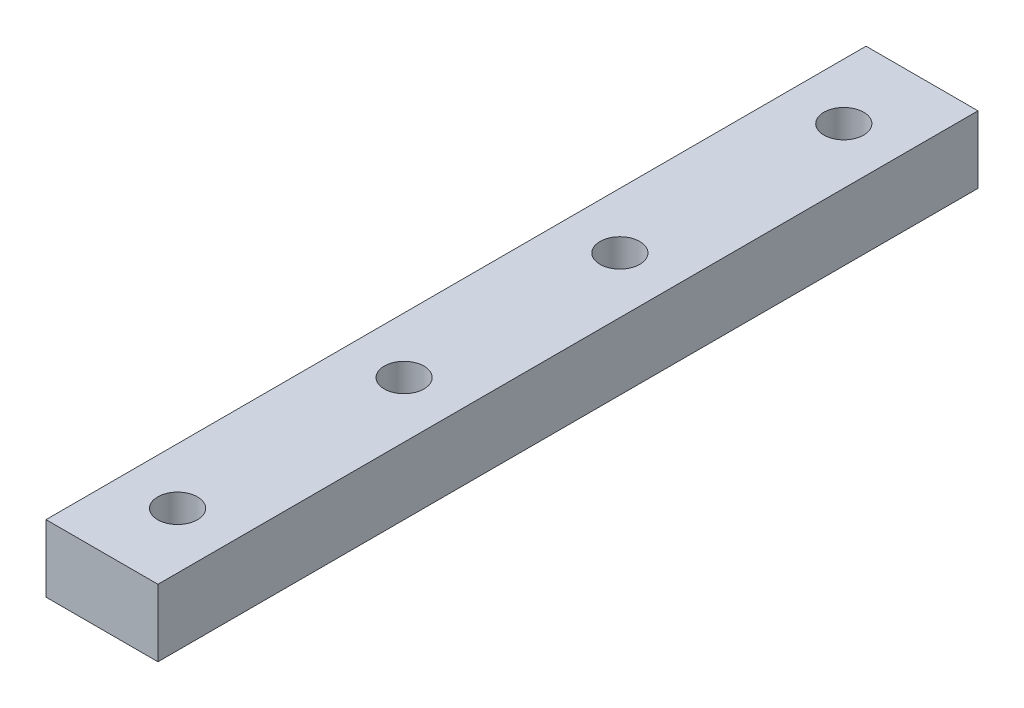
from build123d import *

# Parameters (mm, degrees)
SKETCH1_W                  = 20
SKETCH1_H                  = 146.5
BOSS_EXTRUDE1_DEPTH        = 12
F_7_1_7_1_DIAMETER_HOLE1_D = 7.1


with BuildPart() as part:
    # Sketch1 → Boss-Extrude1 (new body)
    with BuildSketch(Plane(origin=(0, 0, 0), x_dir=(1, 0, 0), z_dir=(0, 1, 0))):
        Rectangle(SKETCH1_W, SKETCH1_H)
    extrude(amount=BOSS_EXTRUDE1_DEPTH)

    # Ø7.1 (7.1) Diameter Hole1 (through all)
    with Locations(Plane(origin=(0, 12, 0), x_dir=(1, 0, 0), z_dir=(0, 1, 0))):
        with Locations((0, 59.275), (0, 19.275), (0, -19.275), (0, -59.745)):
            Hole(F_7_1_7_1_DIAMETER_HOLE1_D / 2)


solid = part.part
